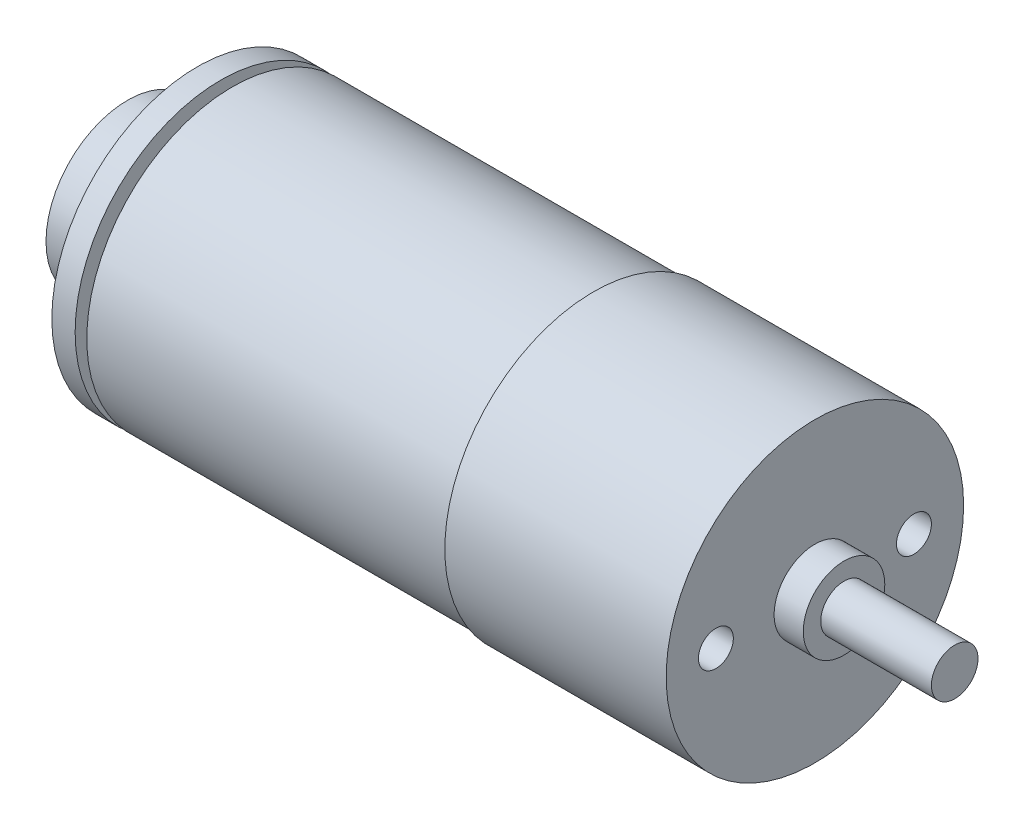
from build123d import *

# Parameters (mm, degrees)
SKETCH_1_R          = 12.5
EXTRUDE_1_DEPTH     = 31
SKETCH_2_R          = 12.76725859
EXTRUDE_2_DEPTH     = 19
SKETCH_3_R          = 3.5
EXTRUDE_3_DEPTH     = 2.5
SKETCH_4_R          = 2
EXTRUDE_4_DEPTH     = 9.5
EXTRUDE_START       = 1
SKETCH_5_R          = 12.5
EXTRUDE_5_DEPTH     = 2
SKETCH_6_R          = 1.579870025
EXTRUDE_6_DEPTH     = 4
SKETCH_7_R          = 7
EXTRUDE_7_DEPTH     = 6
SKETCH_8_R          = 1.5
CUT_EXTRUDE_1_DEPTH = 3


with BuildPart() as part:
    # 草图1 → 凸台-拉伸1 (new body)
    with BuildSketch(Plane(origin=(0, 0, 0), x_dir=(0, 0, -1), z_dir=(1, 0, 0))):
        Circle(SKETCH_1_R)
    extrude(amount=EXTRUDE_1_DEPTH)

    # 草图2 → 凸台-拉伸2 (add)
    with BuildSketch(Plane(origin=(31, 0, 0), x_dir=(0, 0, -1), z_dir=(1, 0, 0))):
        Circle(SKETCH_2_R)
    extrude(amount=EXTRUDE_2_DEPTH)

    # 草图3 → 凸台-拉伸3 (add)
    with BuildSketch(Plane(origin=(50, 0, 0), x_dir=(0, 0, -1), z_dir=(1, 0, 0))):
        Circle(SKETCH_3_R)
    extrude(amount=EXTRUDE_3_DEPTH)

    # 草图4 → 凸台-拉伸4 (add)
    with BuildSketch(Plane(origin=(52.5, 0, 0), x_dir=(0, 0, -1), z_dir=(1, 0, 0))):
        Circle(SKETCH_4_R)
    extrude(amount=EXTRUDE_4_DEPTH)



with BuildPart() as body_2:
    # 草图5 → 凸台-拉伸5 (new body)
    with BuildSketch(Plane.ZY.offset(EXTRUDE_START)):
        with Locations(Location((0, 0, 0), (0, 0, 180))):
            Circle(SKETCH_5_R)
    extrude(amount=EXTRUDE_5_DEPTH)


with BuildPart() as part_1:
    add(part.part)

    add(body_2.part)  # 凸台-拉伸6 merges body 2
    # 草图6 → 凸台-拉伸6 (add)
    with BuildSketch(Plane.ZY.offset(3)):
        Circle(SKETCH_6_R)
    extrude(amount=-EXTRUDE_6_DEPTH)

    # 草图7 → 凸台-拉伸7 (add)
    with BuildSketch(Plane.ZY.offset(3)):
        Circle(SKETCH_7_R)
    extrude(amount=EXTRUDE_7_DEPTH)

    # 草图8 → 切除-拉伸1 (cut)
    with BuildSketch(Plane(origin=(50, 0, 0), x_dir=(0, 0, -1), z_dir=(1, 0, 0))):
        with Locations((8.5, 0)):
            Circle(SKETCH_8_R)
        with Locations(Location((-8.5, 0, 0), (0, 0, 180))):
            Circle(SKETCH_8_R)
    extrude(amount=-CUT_EXTRUDE_1_DEPTH, mode=Mode.SUBTRACT)


solid = part_1.part
